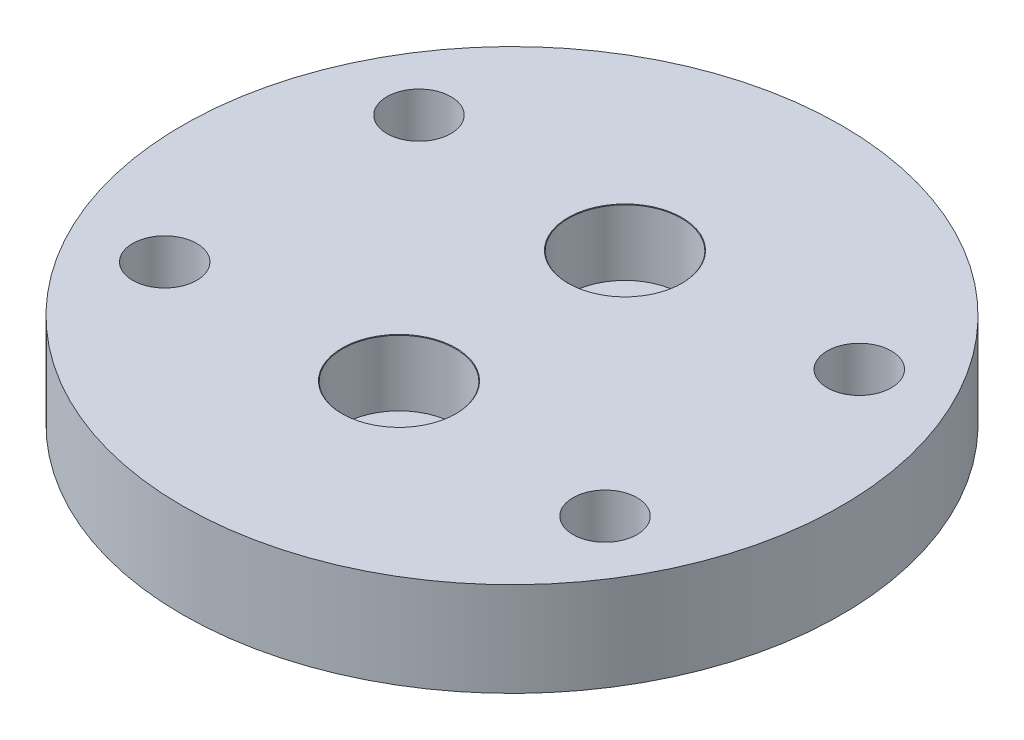
from build123d import *

# Parameters (mm, degrees)
SKETCH_1_R                    = 17.5
EXTRUDE_1_DEPTH               = 5
HOLE_WIZARD_M3_1_D            = 3.4
HOLE_WIZARD_M3_1_CSINK_D      = 3.45
HOLE_WIZARD_M3_1_CSINK_ANGLE  = 90
PATTERN_CIRCULAR_1_COUNT      = 6
HOLE_WIZARD_M3_1_2_AT_2_COUNT = 2
HOLE_WIZARD_M3_1_2_AT_2_PITCH = 12


with BuildPart() as part:
    # 草图1 → 凸台-拉伸1 (new body)
    with BuildSketch(Plane(origin=(0, 0, 0), x_dir=(1, 0, 0), z_dir=(0, 1, 0))):
        with Locations(Location((0, 0, 0), (0, 0, 270))):
            Circle(SKETCH_1_R)
    extrude(amount=EXTRUDE_1_DEPTH)

    # Hole Wizard M3 _1 (through all)
    with Locations(Plane(origin=(0, 0, 0), x_dir=(-1, 0, 0), z_dir=(0, -1, 0))):
        with Locations((11.691342951, 6.75)):
            hole_wizard_m3_1 = CounterSinkHole(HOLE_WIZARD_M3_1_D / 2, HOLE_WIZARD_M3_1_CSINK_D / 2, counter_sink_angle=HOLE_WIZARD_M3_1_CSINK_ANGLE)

    # 阵列(圆周)1: Hole Wizard M3 _1 ×6 about axis, 2 skipped
    pattern_circular_1_axis = Axis((0, 0, 0), (0, -1, 0))
    add([hole_wizard_m3_1.rotate(pattern_circular_1_axis, i * 360 / PATTERN_CIRCULAR_1_COUNT) for i in range(1, PATTERN_CIRCULAR_1_COUNT) if i not in (1, 4)], mode=Mode.SUBTRACT)

    # 草图6 → Hole Wizard M3 _1 2 (revolve, cut)
    with BuildSketch(Plane(origin=(0, 5, -6), x_dir=(0, 0, 1), z_dir=(1, 0, 0))):
        Polygon((0, 0), (0, 5), (1.7, 5), (1.7, 3.5), (3, 3.5), (3, 0.025), (3.025, 0), align=None)
    hole_wizard_m3_1_2 = revolve(axis=Axis((0, 11.35, -6), (0, -1, 0)), mode=Mode.SUBTRACT)

    # Hole Wizard M3 _1 2 at 2: Hole Wizard M3 _1 2 ×2
    with Locations(*[(0, 0, i * HOLE_WIZARD_M3_1_2_AT_2_PITCH) for i in range(1, HOLE_WIZARD_M3_1_2_AT_2_COUNT)]):
        add(hole_wizard_m3_1_2, mode=Mode.SUBTRACT)


solid = part.part
